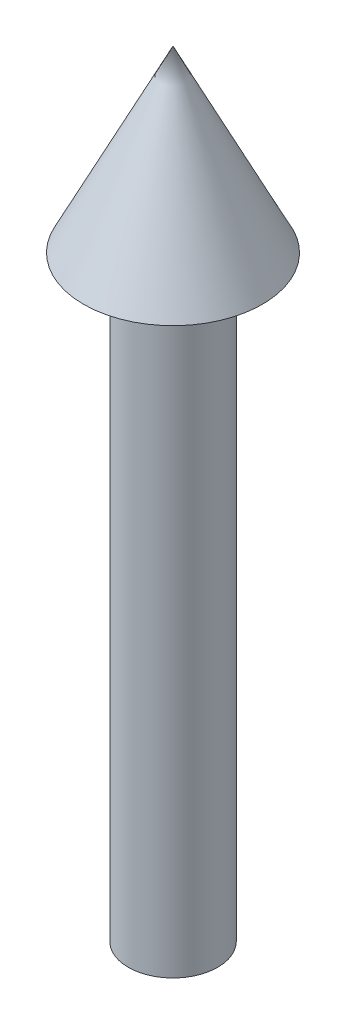
from build123d import *

# Parameters (mm, degrees)
SKETCH1_R           = 1.5
BOSS_EXTRUDE1_DEPTH = 20


with BuildPart() as part:
    # Sketch1 → Boss-Extrude1 (new body)
    with BuildSketch(Plane(origin=(0, 0, 0), x_dir=(1, 0, 0), z_dir=(0, 1, 0))):
        with Locations(Location((0, 0, 0), (0, 0, 270))):
            Circle(SKETCH1_R)
    extrude(amount=BOSS_EXTRUDE1_DEPTH)

    # Sketch3 → Revolve1 (revolve)
    with BuildSketch(Plane(origin=(0, 0, 0), x_dir=(0, 0, -1), z_dir=(1, 0, 0)), mode=Mode.PRIVATE) as revolve1_sk:
        Polygon((0, 20), (-3, 20), (0, 26), align=None)
    revolve(revolve1_sk.sketch.rotate(Axis((0, 26, 0), (0, -1, 0)), 180), axis=Axis((0, 26, 0), (0, -1, 0)))


solid = part.part
